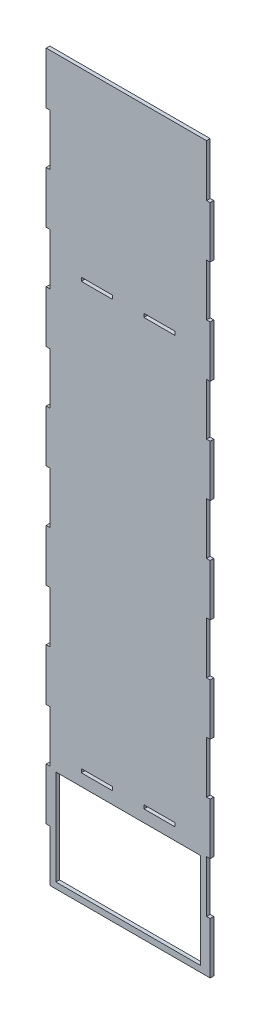
from build123d import *

# Parameters (mm, degrees)
SKETCH1_W           = 120
SKETCH1_H           = 79
SKETCH1_W_2         = 25.82
SKETCH1_H_2         = 3
BOSS_EXTRUDE1_DEPTH = 3


with BuildPart() as part:
    # Sketch1 → Boss-Extrude1 (new body)
    with BuildSketch(Plane.XY):
        Polygon((-68, 0), (65, 0), (65, -43.007142857), (68, -43.007142857), (68, -85.714285714), (65, -85.714285714), (65, -128.721428571), (68, -128.721428571), (68, -171.428571429), (65, -171.428571429), (65, -214.435714286), (68, -214.435714286), (68, -257.142857143), (65, -257.142857143), (65, -300.15), (68, -300.15), (68, -342.857142857), (65, -342.857142857), (65, -385.864285714), (68, -385.864285714), (68, -428.571428571), (65, -428.571428571), (65, -471.578571429), (68, -471.578571429), (68, -514.285714286), (65, -514.285714286), (65, -557.292857143), (68, -557.292857143), (68, -600), (-65, -600), (-65, -557.292857143), (-68, -557.292857143), (-68, -514.285714286), (-65, -514.285714286), (-65, -471.578571429), (-68, -471.578571429), (-68, -428.571428571), (-65, -428.571428571), (-65, -385.864285714), (-68, -385.864285714), (-68, -342.857142857), (-65, -342.857142857), (-65, -300.15), (-68, -300.15), (-68, -257.142857143), (-65, -257.142857143), (-65, -214.435714286), (-68, -214.435714286), (-68, -171.428571429), (-65, -171.428571429), (-65, -128.721428571), (-68, -128.721428571), (-68, -85.714285714), (-65, -85.714285714), (-65, -43.007142857), (-68, -43.007142857), align=None)
        with Locations((0, -555.5)):
            Rectangle(SKETCH1_W, SKETCH1_H, mode=Mode.SUBTRACT)
        with Locations((-25.97, -151.5)):
            Rectangle(SKETCH1_W_2, SKETCH1_H_2, mode=Mode.SUBTRACT)
        with Locations((25.97, -151.5)):
            Rectangle(SKETCH1_W_2, SKETCH1_H_2, mode=Mode.SUBTRACT)
        with Locations((-25.97, -504.5)):
            Rectangle(SKETCH1_W_2, SKETCH1_H_2, mode=Mode.SUBTRACT)
        with Locations((25.97, -504.5)):
            Rectangle(SKETCH1_W_2, SKETCH1_H_2, mode=Mode.SUBTRACT)
    extrude(amount=BOSS_EXTRUDE1_DEPTH)


solid = part.part
